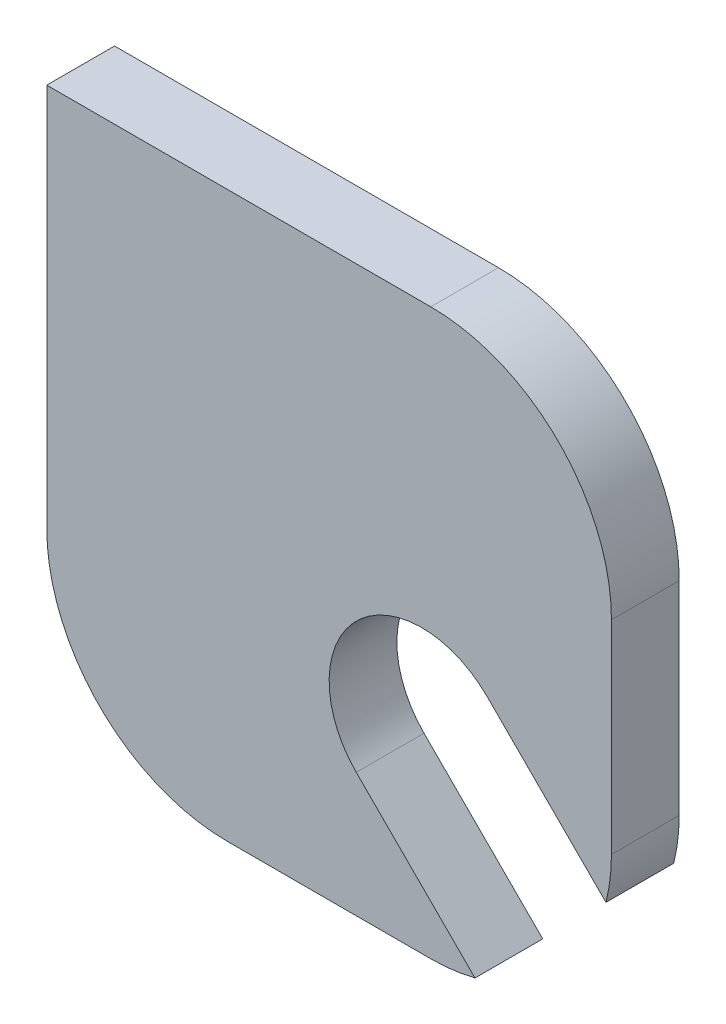
from build123d import *

# Parameters (mm, degrees)
SKETCH_1_W          = 25
SKETCH_1_H          = 25
EXTRUDE_1_DEPTH     = 3
FILLET_1_R          = 8
FILLET_2_R          = 8
FILLET_3_R          = 8
SKETCH_2_R          = 4.1
CUT_EXTRUDE_1_DEPTH = 3
CUT_EXTRUDE_2_DEPTH = 3


with BuildPart() as part:
    # 草图1 → 凸台-拉伸1 (new body)
    with BuildSketch(Plane.XY):
        Rectangle(SKETCH_1_W, SKETCH_1_H)
    extrude(amount=EXTRUDE_1_DEPTH)

    # 圆角1
    fillet_1_edges = [part.edges().sort_by_distance(p)[0] for p in [
        (-12.5, -12.5, 1.5),
    ]]
    fillet(fillet_1_edges, radius=FILLET_1_R)

    # 圆角2
    fillet_2_edges = [part.edges().sort_by_distance(p)[0] for p in [
        (12.5, -12.5, 1.5),
    ]]
    fillet(fillet_2_edges, radius=FILLET_2_R)

    # 圆角3
    fillet_3_edges = [part.edges().sort_by_distance(p)[0] for p in [
        (12.5, 12.5, 1.5),
    ]]
    fillet(fillet_3_edges, radius=FILLET_3_R)

    # 草图2 → 切除-拉伸1 (cut)
    with BuildSketch(Plane.XY.offset(3)):
        with Locations((4.1, -4.1)):
            Circle(SKETCH_2_R)
    extrude(amount=-CUT_EXTRUDE_1_DEPTH, mode=Mode.SUBTRACT)

    # 草图3 → 切除-拉伸2 (cut)
    with BuildSketch(Plane.XY.offset(3)):
        with BuildLine():
            Line((12.256606279, -6.458330674), (6.999137803, -1.200862197))
            ThreePointArc((6.999137803, -1.200862197), (6.999137803, -6.999137803), (1.200862197, -6.999137803))
            Line((1.200862197, -6.999137803), (6.458330674, -12.256606279))
            ThreePointArc((6.458330674, -12.256606279), (10.156854249, -10.156854249), (12.256606279, -6.458330674))
        make_face()
    extrude(amount=-CUT_EXTRUDE_2_DEPTH, mode=Mode.SUBTRACT)


solid = part.part
